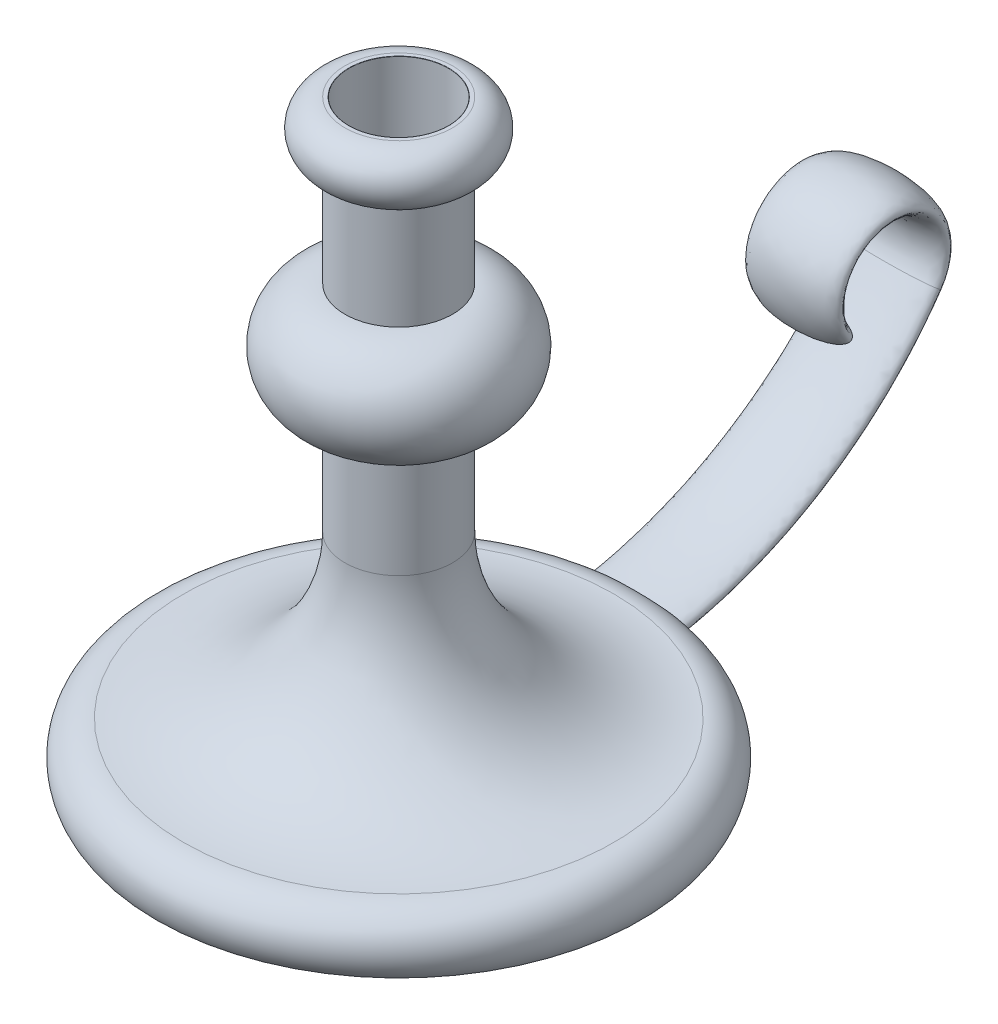
from build123d import *

# Parameters (mm, degrees)
SKETCH4_R          = 469.9
CUT_EXTRUDE1_DEPTH = 5033.264
FILLET2_R          = 2.54
SKETCH7_RX         = 444.5
SKETCH7_RY         = 127


with BuildPart() as part:
    # Sketch1 → Revolve2 (revolve)
    with BuildSketch(Plane.XY, mode=Mode.PRIVATE) as revolve2_sk:
        with BuildLine():
            Line((0, 0), (0, 5588))
            Line((0, 5588), (508, 5588))
            ThreePointArc((508, 5588), (762, 5333.999954135), (507.999908271, 5080))
            Line((507.999908271, 5080), (507.999908271, 4064))
            ThreePointArc((507.999908271, 4064), (1015.999908271, 3556), (507.999908271, 3048))
            Line((507.999908271, 3048), (507.999908271, 2032))
            ThreePointArc((507.999908271, 2032), (954.369200582, 954.369238632), (2031.999984185, 508))
            ThreePointArc((2031.999984185, 508), (2315.980629606, 332.490323644), (2286, 0))
            Line((2286, 0), (0, 0))
        make_face()
    revolve(revolve2_sk.sketch.rotate(Axis((0, 0, 0), (0, 1, 0)), 90), axis=Axis((0, 0, 0), (0, 1, 0)))

    # Sketch4 → Cut-Extrude1 (cut)
    with BuildSketch(Plane(origin=(0, 5588, 0), x_dir=(1, 0, 0), z_dir=(0, 1, 0))):
        with Locations(Location((0, 0, 0), (0, 0, 270))):
            Circle(SKETCH4_R)
    extrude(amount=-CUT_EXTRUDE1_DEPTH, mode=Mode.SUBTRACT)

    # Fillet2
    fillet2_edges = [part.edges().sort_by_distance(p)[0] for p in [
        (0, 5588, -469.9),
    ]]
    fillet(fillet2_edges, radius=FILLET2_R)

    # Sweep1: sweep along a path in Sketch6
    with BuildLine(Plane(origin=(0, 0, 0), x_dir=(0, 0, -1), z_dir=(1, 0, 0))) as sweep1_path:
        Line((0, 254), (1524, 254))
        ThreePointArc((1524, 254), (3297.458485559, 691.916815973), (4663.238601954, 1905))
        ThreePointArc((4663.238601954, 1905), (4244.673455027, 2700.866666667), (3826.1083081, 1905))
    # Sketch7 → Sweep1 (sweep)
    with BuildSketch(Plane.XY):
        with Locations((0, 254)):
            Ellipse(SKETCH7_RX, SKETCH7_RY)
    sweep(path=sweep1_path.line)


solid = part.part
